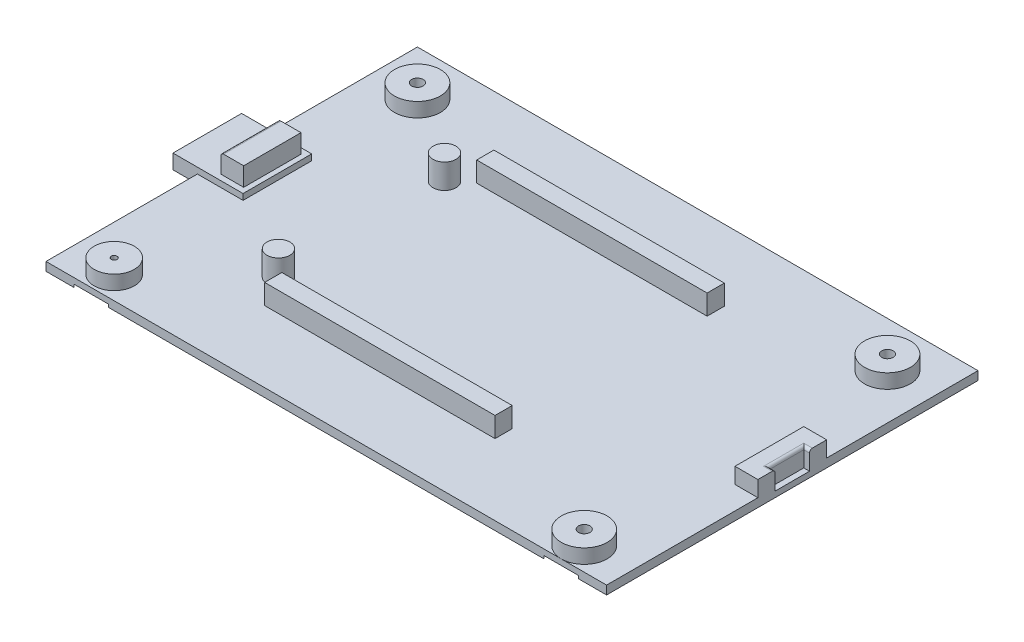
from build123d import *

# Parameters (mm, degrees)
EXTRUDE_1_DEPTH     = 1.5
SKETCH_2_R          = 5
CUT_EXTRUDE_1_DEPTH = 0.5
SKETCH_11_R         = 2
SKETCH_11_W         = 12.230000074
SKETCH_11_H         = 11.97459995
EXTRUDE_5_DEPTH     = 2.539974634
SKETCH_13_R         = 2
SKETCH_13_W         = 4
SKETCH_13_H         = 10
TYPEC_2_DEPTH       = 5.7999746
LED_3_START         = -4.25
LED_3_DEPTH         = 2.75
LED_1_R             = 0.5
CUT_EXTRUDE_2_REACH = 76.258
SKETCH_15_R         = 2
EXTRUDE_START       = -4
SKETCH_16_R         = 4
SKETCH_16_R_2       = 1
SKETCH_16_R_3       = 3.5
SKETCH_16_R_4       = 0.5
EXTRUDE_4_DEPTH     = 2.5
LED_2_START         = -1.5
SKETCH_17_W         = 1
SKETCH_17_H         = 6
LED_2_DEPTH         = 0.5
SKETCH_18_W         = 40.2
SKETCH_18_H         = 3
EXTRUDE_2_DEPTH     = 3.5


with BuildPart() as part:
    # 草图1 → 凸台-拉伸1 (new body)
    with BuildSketch(Plane(origin=(0, 0, 0), x_dir=(1, 0, 0), z_dir=(0, 1, 0))):
        Polygon((-51.714401711, -10.060969859), (-55.976720774, -10.060969859), (-55.976720774, -22.035569809), (-51.714401711, -22.035569809), (-51.714401711, -48.448269834), (46.085598289, -48.448269834), (46.085598289, 16.351730166), (-51.714401711, 16.351730166), align=None)
    extrude(amount=EXTRUDE_1_DEPTH)

    # 草图2 → 防滑切除-拉伸1 (cut)
    with BuildSketch(Plane.XZ):
        with Locations((-43.814401711, 44.448269834)):
            Circle(SKETCH_2_R)
        with Locations((38.185598289, 44.448269834)):
            Circle(SKETCH_2_R)
        with Locations(Location((38.185598289, -8.451730166, 0), (0, 0, 90))):
            Circle(SKETCH_2_R)
        with Locations(Location((-43.814401711, -8.451730166, 0), (0, 0, 270))):
            Circle(SKETCH_2_R)
    extrude(amount=-CUT_EXTRUDE_1_DEPTH, mode=Mode.SUBTRACT)

    # 草图11 → 充电板档板凸台-拉伸5 (add)
    with BuildSketch(Plane.XZ):
        with Locations((-29.074401711, 30.535569809)):
            Circle(SKETCH_11_R)
        with Locations((-29.074401711, 1.560969859)):
            Circle(SKETCH_11_R)
        with Locations((-49.861720737, 16.048269834)):
            Rectangle(SKETCH_11_W, SKETCH_11_H)
    extrude(amount=-EXTRUDE_5_DEPTH)

    # 草图13 → TypeC支撑凸台-拉伸2 (add)
    with BuildSketch(Plane.XZ):
        with Locations(Location((-29.074401711, 30.535569809, 0), (0, 0, 90))):
            Circle(SKETCH_13_R)
        with Locations(Location((-29.074401711, 1.560969859, 0), (0, 0, 90))):
            Circle(SKETCH_13_R)
        with Locations((-46.6267207, 16.048269834)):
            Rectangle(SKETCH_13_W, SKETCH_13_H)
    extrude(amount=-TYPEC_2_DEPTH)

    # 草图14 → LED限位凸台-拉伸3 (add)
    with BuildSketch(Plane.XZ.offset(LED_3_START)):
        Polygon((45.085598289, 13.048269834), (45.085598289, 19.048269834), (46.085598289, 19.048269834), (46.085598289, 22.048269834), (42.085598289, 22.048269834), (42.085598289, 10.048269834), (46.085598289, 10.048269834), (46.085598289, 13.048269834), align=None)
    extrude(amount=LED_3_DEPTH)

    # LED限位圆角1
    led_1_edges = [part.edges().sort_by_distance(p)[0] for p in [
        (-48.6267207, 5.7999746, 16.048269834),
        (45.585598289, 4.25, 19.048269834),
        (45.585598289, 4.25, 13.048269834),
        (45.085598289, 4.25, 16.048269834),
    ]]
    fillet(led_1_edges, radius=LED_1_R)

    # 草图15 → 螺丝孔位切除-拉伸2 (cut, up to next)
    with BuildSketch(Plane.XZ, mode=Mode.PRIVATE) as cut_extrude_2_sk1:
        with Locations(Location((-43.814401711, -8.451730166, 0), (0, 0, 270))):
            Circle(SKETCH_15_R)
    cut_extrude_2_tool1 = extrude(cut_extrude_2_sk1.sketch, amount=-CUT_EXTRUDE_2_REACH, mode=Mode.PRIVATE) & part.part
    # 草图15 → 螺丝孔位切除-拉伸2 (cut, up to next)
    with BuildSketch(Plane.XZ, mode=Mode.PRIVATE) as cut_extrude_2_sk2:
        with Locations(Location((-43.814401711, 44.448269834, 0), (0, 0, 270))):
            Circle(SKETCH_15_R)
    cut_extrude_2_tool2 = extrude(cut_extrude_2_sk2.sketch, amount=-CUT_EXTRUDE_2_REACH, mode=Mode.PRIVATE) & part.part
    # 草图15 → 螺丝孔位切除-拉伸2 (cut, up to next)
    with BuildSketch(Plane.XZ, mode=Mode.PRIVATE) as cut_extrude_2_sk3:
        with Locations(Location((38.185598289, -8.451730166, 0), (0, 0, 270))):
            Circle(SKETCH_15_R)
    cut_extrude_2_tool3 = extrude(cut_extrude_2_sk3.sketch, amount=-CUT_EXTRUDE_2_REACH, mode=Mode.PRIVATE) & part.part
    # 草图15 → 螺丝孔位切除-拉伸2 (cut, up to next)
    with BuildSketch(Plane.XZ, mode=Mode.PRIVATE) as cut_extrude_2_sk4:
        with Locations(Location((38.185598289, 44.448269834, 0), (0, 0, 270))):
            Circle(SKETCH_15_R)
    cut_extrude_2_tool4 = extrude(cut_extrude_2_sk4.sketch, amount=-CUT_EXTRUDE_2_REACH, mode=Mode.PRIVATE) & part.part
    add(cut_extrude_2_tool1.solids().sort_by_distance((-43.814402, 0, -8.45173))[0], mode=Mode.SUBTRACT)
    add(cut_extrude_2_tool2.solids().sort_by_distance((-43.814402, 0, 44.44827))[0], mode=Mode.SUBTRACT)
    add(cut_extrude_2_tool3.solids().sort_by_distance((38.185598, 0, -8.45173))[0], mode=Mode.SUBTRACT)
    add(cut_extrude_2_tool4.solids().sort_by_distance((38.185598, 0, 44.44827))[0], mode=Mode.SUBTRACT)

    # 草图16 → 螺丝孔凸台-拉伸4 (add)
    # profile 1 of 4: a face of its own
    with BuildSketch(Plane.XZ.offset(EXTRUDE_START)):
        with Locations((38.185598289, -8.451730166)):
            Circle(SKETCH_16_R)
        with Locations((38.185598289, -8.451730166)):
            Circle(SKETCH_16_R_2, mode=Mode.SUBTRACT)
    # profile 2 of 4: a face of its own
    with BuildSketch(Plane.XZ.offset(EXTRUDE_START)):
        with Locations((38.185598289, 44.448269834)):
            Circle(SKETCH_16_R)
        with Locations((38.185598289, 44.448269834)):
            Circle(SKETCH_16_R_2, mode=Mode.SUBTRACT)
    # profile 3 of 4: a face of its own
    with BuildSketch(Plane.XZ.offset(EXTRUDE_START)):
        with Locations((-43.814401711, -8.451730166)):
            Circle(SKETCH_16_R)
        with Locations((-43.814401711, -8.451730166)):
            Circle(SKETCH_16_R_2, mode=Mode.SUBTRACT)
    # profile 4 of 4: a face of its own
    with BuildSketch(Plane.XZ.offset(EXTRUDE_START)):
        with Locations((-43.814401711, 44.448269834)):
            Circle(SKETCH_16_R_3)
        with Locations((-43.814401711, 44.448269834)):
            Circle(SKETCH_16_R_4, mode=Mode.SUBTRACT)
    extrude(amount=EXTRUDE_4_DEPTH)

    # 草图17 → LED灯嵌入切除-拉伸2 (cut)
    with BuildSketch(Plane.XZ.offset(LED_2_START)):
        with Locations((45.585598289, 16.048269834)):
            Rectangle(SKETCH_17_W, SKETCH_17_H)
    extrude(amount=LED_2_DEPTH, mode=Mode.SUBTRACT)

    # 草图18 → 散热板支撑凸台-拉伸2 (add)
    with BuildSketch(Plane(origin=(0, 1.5, 0), x_dir=(1, 0, 0), z_dir=(0, 1, 0))):
        with Locations((-5.874401711, 2.451730166)):
            Rectangle(SKETCH_18_W, SKETCH_18_H)
        with Locations((-5.874401711, -34.548269834)):
            Rectangle(SKETCH_18_W, SKETCH_18_H)
    extrude(amount=EXTRUDE_2_DEPTH)


solid = part.part
